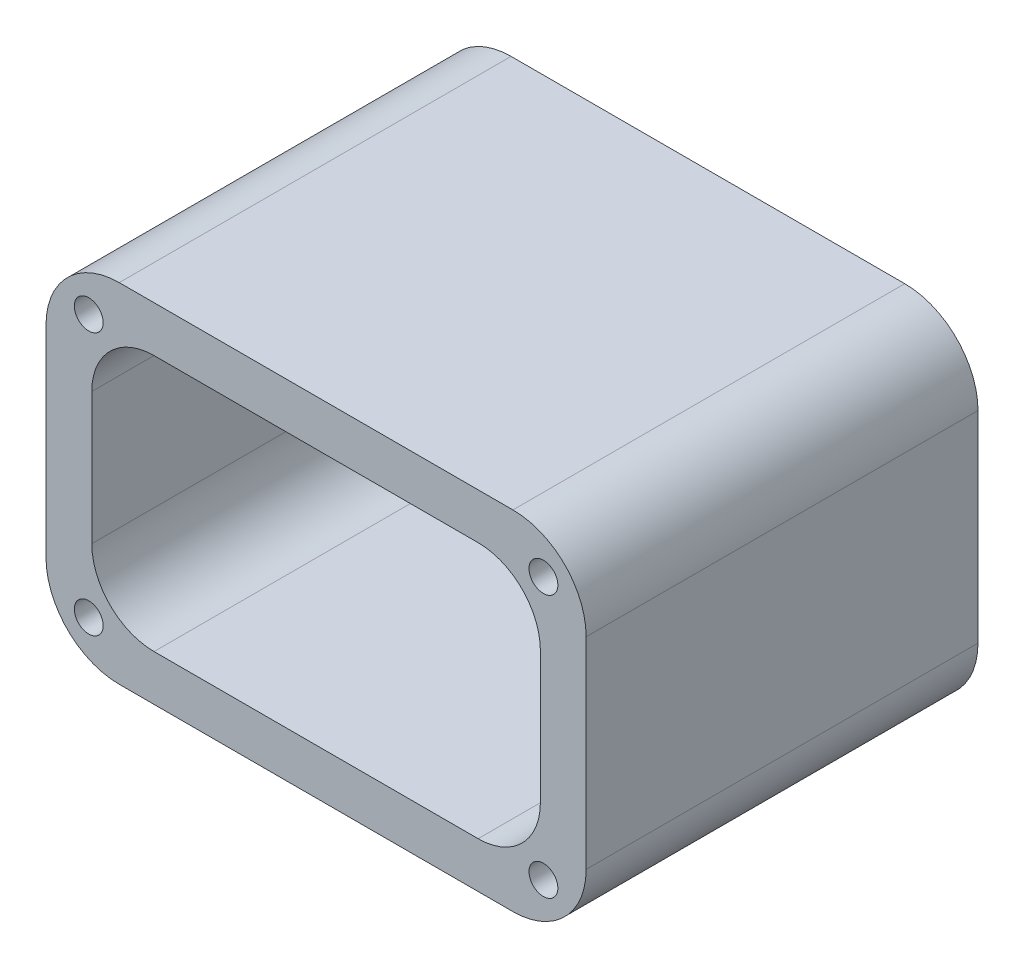
from build123d import *

# Parameters (mm, degrees)
SKETCH2_W           = 37.465
SKETCH2_H           = 24.13
BOSS_EXTRUDE1_DEPTH = 24.892
CUT_EXTRUDE1_DEPTH  = 20.701
CUT_EXTRUDE3_DEPTH  = 4.191
FILLET1_R           = 5.08
BOSS_EXTRUDE3_START = 2.286
BOSS_EXTRUDE3_DEPTH = 2.286
SKETCH8_R           = 1.905
CUT_EXTRUDE4_DEPTH  = 7.62
BOSS_EXTRUDE5_START = 2.286
BOSS_EXTRUDE5_DEPTH = 2.286
SKETCH10_R          = 1
CUT_EXTRUDE5_DEPTH  = 4


with BuildPart() as part:
    # Sketch2 → Boss-Extrude1 (new body)
    with BuildSketch(Plane.XY):
        with Locations((18.7325, 12.065)):
            Rectangle(SKETCH2_W, SKETCH2_H)
    extrude(amount=BOSS_EXTRUDE1_DEPTH)

    # Sketch3 → Cut-Extrude1 (cut)
    with BuildSketch(Plane.XY.offset(24.892)):
        with BuildLine():
            ThreePointArc((3.175, 16.637), (4.439712919, 19.690287081), (7.493, 20.955))
            Line((7.493, 20.955), (29.972, 20.955))
            ThreePointArc((29.972, 20.955), (33.025287081, 19.690287081), (34.29, 16.637))
            Line((34.29, 16.637), (34.29, 7.493))
            ThreePointArc((34.29, 7.493), (33.025287081, 4.439712919), (29.972, 3.175))
            Line((29.972, 3.175), (7.493, 3.175))
            ThreePointArc((7.493, 3.175), (4.439712919, 4.439712919), (3.175, 7.493))
            Line((3.175, 7.493), (3.175, 16.637))
        make_face()
    extrude(amount=-CUT_EXTRUDE1_DEPTH, mode=Mode.SUBTRACT)

    # Sketch4 → Cut-Extrude3 (cut)
    with BuildSketch(Plane.XY.offset(4.191)):
        with BuildLine():
            Line((32.086974483, 8.570131), (32.07077796, 10.882539488))
            add(Edge.make_bspline(
                [(32.07077796, 10.882539488), (32.073215089, 11.03512727), (32.05346317, 11.384531492), (31.98348624, 11.89897185), (31.690265244, 12.891461502), (30.781603575, 14.240804474), (29.41900903, 15.119220909), (28.414706523, 15.393168176), (27.909381539, 15.452204781), (27.554769457, 15.464756938), (27.429691001, 15.46229384)],
                knots=[0, 0, 0, 0.046875, 0.09375, 0.1875, 0.375, 0.625, 0.8125, 0.90625, 0.953125, 1, 1, 1], degree=2))
            Line((27.429691001, 15.46229384), (21.587714207, 15.44582783))
            add(Edge.make_bspline(
                [(21.587714207, 15.44582783), (21.462803996, 15.448731855), (21.106730304, 15.437338634), (20.595765352, 15.378996632), (19.591692577, 15.107051395), (18.225687665, 14.229774678), (17.316214622, 12.885953496), (17.020022679, 11.889285009), (16.949885556, 11.382167163), (16.92906595, 11.034797324), (16.930958193, 10.882006896)],
                knots=[0, 0, 0, 0.046875, 0.09375, 0.1875, 0.375, 0.625, 0.8125, 0.90625, 0.953125, 1, 1, 1], degree=2))
            Line((16.930958193, 10.882006896), (16.947147256, 8.570663591))
            add(Edge.make_bspline(
                [(16.947147256, 8.570663591), (16.944692803, 8.418076087), (16.96440505, 8.068669624), (17.034323571, 7.554221325), (17.32743188, 6.561698387), (18.235940341, 5.212252256), (19.598435143, 4.33368112), (20.60270654, 4.059619828), (21.108024818, 4.00052585), (21.462635472, 3.98793343), (21.587714207, 3.990382327)],
                knots=[0, 0, 0, 0.046875, 0.09375, 0.1875, 0.375, 0.625, 0.8125, 0.90625, 0.953125, 1, 1, 1], degree=2))
            Line((21.587714207, 3.990382327), (27.429691002, 4.006848338))
            add(Edge.make_bspline(
                [(27.429691002, 4.006848338), (27.554600877, 4.003929875), (27.910675883, 4.015281941), (28.421647575, 4.073564883), (29.425751775, 4.345394065), (30.791858076, 5.22251289), (31.701486436, 6.566228943), (31.997793574, 7.562863188), (32.067989311, 8.069972924), (32.088849066, 8.417340355), (32.086974483, 8.570131)],
                knots=[0, 0, 0, 0.046875, 0.09375, 0.1875, 0.375, 0.625, 0.8125, 0.90625, 0.953125, 1, 1, 1], degree=2))
        make_face()
    extrude(amount=-CUT_EXTRUDE3_DEPTH, mode=Mode.SUBTRACT)

    # Fillet1
    fillet1_edges = [part.edges().sort_by_distance(p)[0] for p in [
        (0, 24.13, 12.446),
        (37.465, 24.13, 12.446),
        (37.465, 0, 12.446),
        (0, 0, 12.446),
    ]]
    fillet(fillet1_edges, radius=FILLET1_R)

    # Sketch7 → Boss-Extrude3 (add)
    with BuildSketch(Plane.XY.offset(24.892).offset(BOSS_EXTRUDE3_START)):
        with BuildLine():
            ThreePointArc((35.59175, 18.3515), (34.252642204, 21.584392204), (31.01975, 22.9235))
            Line((31.01975, 22.9235), (6.44525, 22.9235))
            ThreePointArc((6.44525, 22.9235), (3.212357796, 21.584392204), (1.87325, 18.3515))
            Line((1.87325, 18.3515), (1.87325, 5.7785))
            ThreePointArc((1.87325, 5.7785), (3.212357796, 2.545607796), (6.44525, 1.2065))
            Line((6.44525, 1.2065), (31.01975, 1.2065))
            ThreePointArc((31.01975, 1.2065), (34.252642204, 2.545607796), (35.59175, 5.7785))
            Line((35.59175, 5.7785), (35.59175, 18.3515))
        make_face()
        with BuildLine():
            ThreePointArc((3.175, 16.637), (4.439712919, 19.690287081), (7.493, 20.955))
            Line((7.493, 20.955), (29.972, 20.955))
            ThreePointArc((29.972, 20.955), (33.025287081, 19.690287081), (34.29, 16.637))
            Line((34.29, 16.637), (34.29, 7.493))
            ThreePointArc((34.29, 7.493), (33.025287081, 4.439712919), (29.972, 3.175))
            Line((29.972, 3.175), (7.493, 3.175))
            ThreePointArc((7.493, 3.175), (4.439712919, 4.439712919), (3.175, 7.493))
            Line((3.175, 7.493), (3.175, 16.637))
        make_face(mode=Mode.SUBTRACT)
    extrude(amount=-BOSS_EXTRUDE3_DEPTH)

    # Sketch8 → Cut-Extrude4 (cut)
    with BuildSketch(Plane.ZY):
        with Locations((12.446, 12.065)):
            Circle(SKETCH8_R)
    extrude(amount=-CUT_EXTRUDE4_DEPTH, mode=Mode.SUBTRACT)

    # Sketch9 → Boss-Extrude5 (add)
    with BuildSketch(Plane.XY.offset(24.892).offset(BOSS_EXTRUDE5_START)):
        with BuildLine():
            Line((37.465, 5.08), (37.465, 19.05))
            ThreePointArc((37.465, 19.05), (35.977102448, 22.642102448), (32.385, 24.13))
            Line((32.385, 24.13), (5.08, 24.13))
            ThreePointArc((5.08, 24.13), (1.487897552, 22.642102448), (0, 19.05))
            Line((0, 19.05), (0, 5.08))
            ThreePointArc((0, 5.08), (1.487897552, 1.487897552), (5.08, 0))
            Line((5.08, 0), (32.385, 0))
            ThreePointArc((32.385, 0), (35.977102448, 1.487897552), (37.465, 5.08))
        make_face()
        with BuildLine():
            Line((6.44525, 1.2065), (31.01975, 1.2065))
            ThreePointArc((31.01975, 1.2065), (34.252642204, 2.545607796), (35.59175, 5.7785))
            Line((35.59175, 5.7785), (35.59175, 18.3515))
            ThreePointArc((35.59175, 18.3515), (34.252642204, 21.584392204), (31.01975, 22.9235))
            Line((31.01975, 22.9235), (6.44525, 22.9235))
            ThreePointArc((6.44525, 22.9235), (3.212357796, 21.584392204), (1.87325, 18.3515))
            Line((1.87325, 18.3515), (1.87325, 5.7785))
            ThreePointArc((1.87325, 5.7785), (3.212357796, 2.545607796), (6.44525, 1.2065))
        make_face(mode=Mode.SUBTRACT)
    extrude(amount=-BOSS_EXTRUDE5_DEPTH)

    # Sketch10 → Cut-Extrude5 (cut)
    with BuildSketch(Plane.XY.offset(27.178)):
        with BuildLine():
            ThreePointArc((3.963805235, 21.166194765), (3.346488668, 22.090074297), (2.256698454, 21.873301546))
            Line((2.256698454, 21.873301546), (3.670912016, 20.459087984))
            ThreePointArc((3.670912016, 20.459087984), (3.887684768, 20.783511332), (3.963805235, 21.166194765))
        make_face()
        with BuildLine():
            Line((3.670912016, 20.459087984), (2.256698454, 21.873301546))
            ThreePointArc((2.256698454, 21.873301546), (2.256698454, 20.459087984), (3.670912016, 20.459087984))
        make_face()
        with Locations((34.501194765, 21.166194765)):
            Circle(SKETCH10_R)
        with Locations((34.501194765, 2.963805235)):
            Circle(SKETCH10_R)
        with Locations((2.963805235, 2.963805235)):
            Circle(SKETCH10_R)
    extrude(amount=-CUT_EXTRUDE5_DEPTH, mode=Mode.SUBTRACT)


solid = part.part
